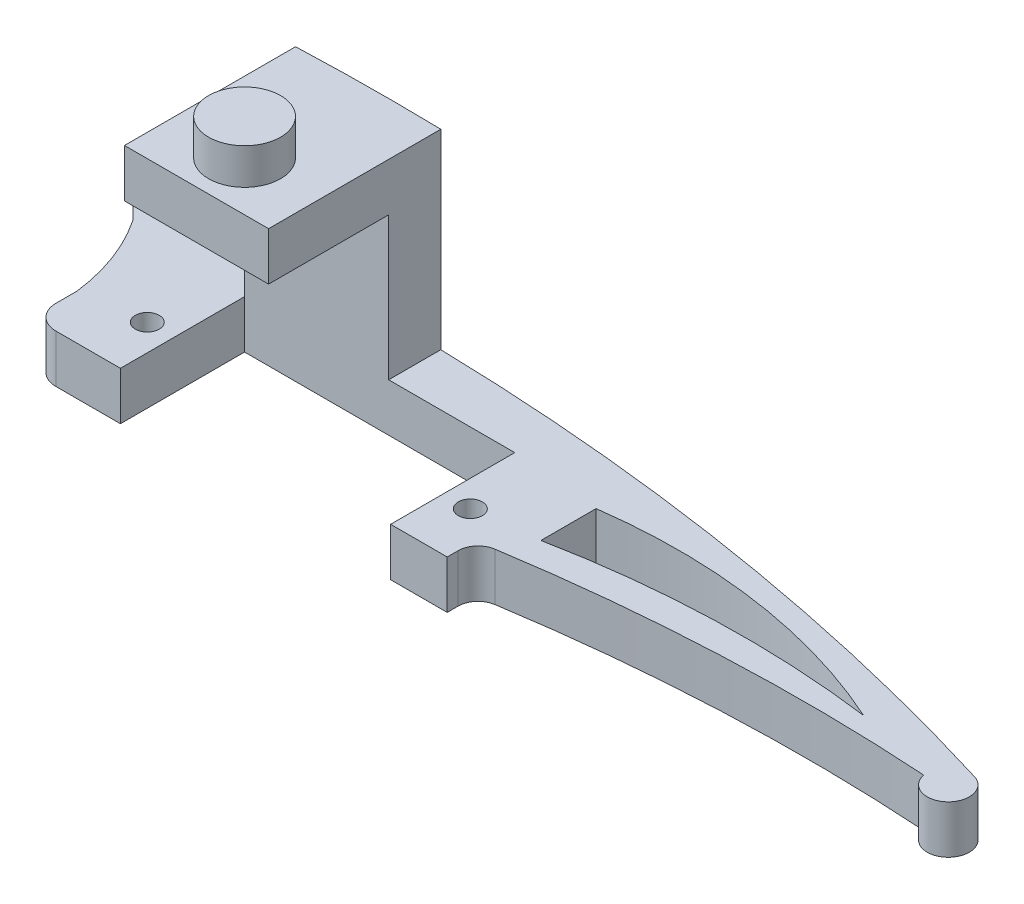
from build123d import *

# Parameters (mm, degrees)
SKETCH1_R           = 1
BOSS_EXTRUDE1_DEPTH = 2
BOSS_EXTRUDE2_START = 15.9
BOSS_EXTRUDE2_DEPTH = 15.9
SKETCH3_W           = 12
SKETCH3_H           = 4
BOSS_EXTRUDE3_DEPTH = 10
SKETCH5_R           = 3
BOSS_EXTRUDE4_DEPTH = 3


with BuildPart() as part:
    # Sketch1 → Boss-Extrude1 (new, symmetric)
    with BuildSketch(Plane(origin=(0, 0, 0), x_dir=(1, 0, 0), z_dir=(0, 1, 0))):
        with BuildLine():
            Line((14, 0), (14, 5.9))
            Line((14, 5.9), (36.5, 5.9))
            Line((36.5, 5.9), (36.5, 0))
            Line((36.5, 0), (36.5, -4.438518159))
            Line((36.5, -4.438518159), (41.213519663, -4.438518159))
            Line((41.213519663, -4.438518159), (41.213519663, -3.536214297))
            ThreePointArc((41.213519663, -3.536214297), (41.613535265, -2.452170394), (42.621822841, -1.887794784))
            ThreePointArc((42.621822841, -1.887794784), (59.657919167, -0.157445784), (76.780825793, -0.327016892))
            ThreePointArc((76.780825793, -0.327016892), (79.667666349, -1.303478154), (79.013446705, 1.672983108))
            ThreePointArc((79.013446705, 1.672983108), (44.912555428, 8.893863941), (10.071688353, 9.954942307))
            ThreePointArc((10.071688353, 9.954942307), (5.913323938, 11.457100516), (1.620293164, 12.514626243))
            ThreePointArc((1.620293164, 12.514626243), (0.158700912, 11.813412309), (0.399525234, 10.21030391))
            Line((0.399525234, 10.21030391), (3.821916897, 6.787912247))
            ThreePointArc((3.821916897, 6.787912247), (5.672488258, 3.21348854), (6.62634024, -0.696918803))
            Line((6.62634024, -0.696918803), (6.62634024, -2.438518159))
            ThreePointArc((6.62634024, -2.438518159), (7.212126678, -3.852731721), (8.62634024, -4.438518159))
            Line((8.62634024, -4.438518159), (14, -4.438518159))
            Line((14, -4.438518159), (14, 0))
        make_face()
        with Locations(Location((11.8, 0, 0), (0, 0, 270))):
            Circle(SKETCH1_R, mode=Mode.SUBTRACT)
        with Locations(Location((38.7, 0, 0), (0, 0, 270))):
            Circle(SKETCH1_R, mode=Mode.SUBTRACT)
        with BuildLine():
            Line((43.924254337, 5.25), (43.924254337, 0.65))
            ThreePointArc((43.924254337, 0.65), (56.919306874, 2.126797691), (69.981420933, 1.468391921))
            ThreePointArc((69.981420933, 1.468391921), (57.21989374, 5.199345781), (43.924254337, 5.25))
        make_face(mode=Mode.SUBTRACT)
    extrude(amount=BOSS_EXTRUDE1_DEPTH, both=True)

    # Sketch2 → Boss-Extrude2 (add)
    with BuildSketch(Plane(origin=(0, 2, 0), x_dir=(1, 0, 0), z_dir=(0, 1, 0)).offset(BOSS_EXTRUDE2_START)):
        with BuildLine():
            Line((14, 5.9), (14, 10.146104419))
            ThreePointArc((14, 10.146104419), (19.999270016, 10.285681215), (26, 10.241385974))
            Line((26, 10.241385974), (26, 5.9))
            Line((26, 5.9), (14, 5.9))
        make_face()
    extrude(amount=-BOSS_EXTRUDE2_DEPTH)

    # Sketch3 → Boss-Extrude3 (add)
    with BuildSketch(Plane.XY.offset(-5.9)):
        with Locations((20, 15.9)):
            Rectangle(SKETCH3_W, SKETCH3_H)
    extrude(amount=BOSS_EXTRUDE3_DEPTH)

    # Sketch5 → Boss-Extrude4 (add)
    with BuildSketch(Plane(origin=(0, 17.9, 0), x_dir=(1, 0, 0), z_dir=(0, 1, 0))):
        with Locations(Location((19.9, 0, 0), (0, 0, 270))):
            Circle(SKETCH5_R)
    extrude(amount=BOSS_EXTRUDE4_DEPTH)


solid = part.part
